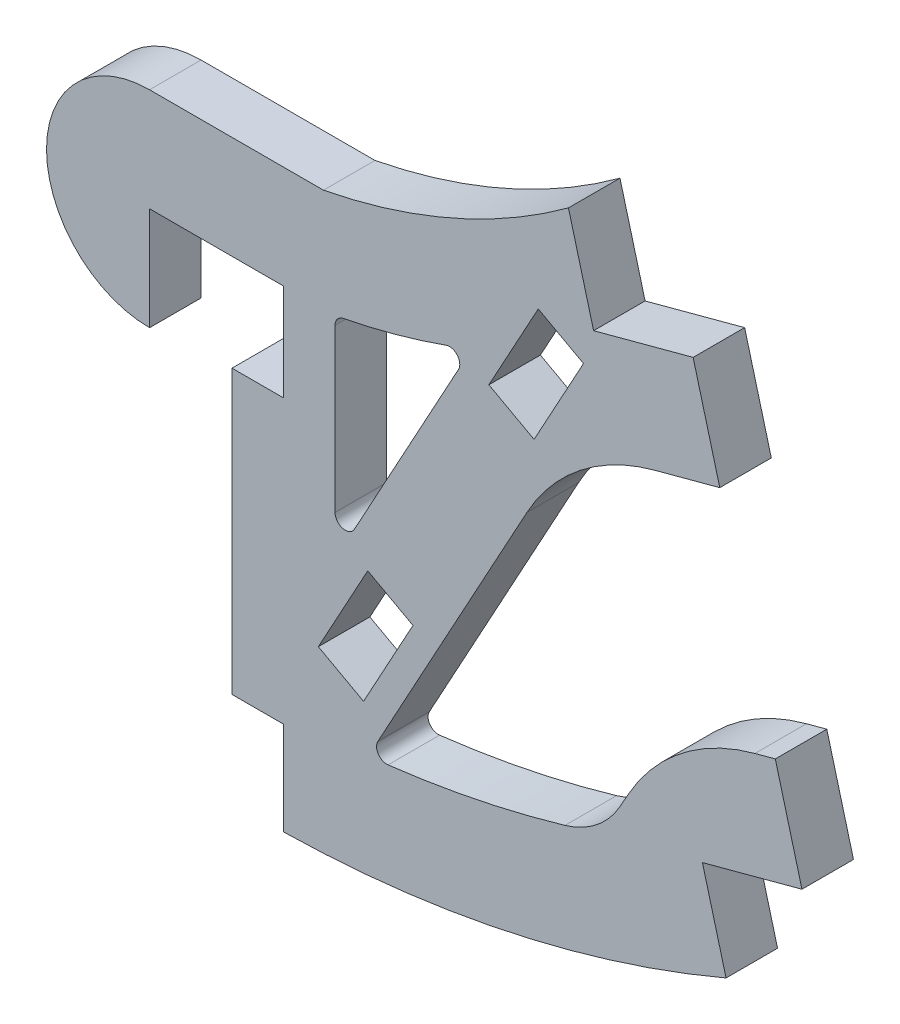
from build123d import *

# Parameters (mm, degrees)
BOSS_EXTRUDE1_DEPTH = 6.35


with BuildPart() as part:
    # Sketch1 → Boss-Extrude1 (new body)
    with BuildSketch(Plane.XY):
        with BuildLine():
            Line((-13.814468498, 55.753), (-0.512454363, 55.753))
            Line((-0.512454363, 55.753), (2.695531502, 55.756757116))
            Line((2.695531502, 55.756757116), (2.695531502, 43.818757116))
            Line((2.695531502, 43.818757116), (-3.654468498, 43.818757116))
            Line((-3.654468498, 43.818757116), (-3.654468498, 8.990868624))
            Line((-3.654468498, 8.990868624), (2.695531502, 8.990868624))
            Line((2.695531502, 8.990868624), (2.695531502, -2.512333634))
            ThreePointArc((2.695531502, -2.512333634), (30.527357476, 0.70923947), (57.236842715, 9.170472751))
            Line((57.236842715, 9.170472751), (54.325835419, 20.034499879))
            Line((54.325835419, 20.034499879), (66.593093413, 23.321501752))
            Line((66.593093413, 23.321501752), (63.30609154, 35.588759746))
            Line((63.30609154, 35.588759746), (60.796097964, 34.916208994))
            ThreePointArc((60.796097964, 34.916208994), (51.793653569, 30.444949555), (45.230580184, 22.831656326))
            Line((45.230580184, 22.831656326), (44.147031561, 20.904803413))
            ThreePointArc((44.147031561, 20.904803413), (41.295489117, 17.558815877), (37.391946488, 15.536618596))
            ThreePointArc((37.391946488, 15.536618596), (26.579212526, 12.858245248), (15.581150656, 11.088630994))
            ThreePointArc((15.581150656, 11.088630994), (14.379521981, 11.63871145), (14.317303994, 12.958798154))
            Line((14.317303994, 12.958798154), (32.704850479, 46.608917104))
            ThreePointArc((32.704850479, 46.608917104), (39.295996489, 54.397381198), (48.420216702, 58.963778482))
            Line((48.420216702, 58.963778482), (56.465172321, 61.119417843))
            Line((56.465172321, 61.119417843), (53.178170448, 73.386675837))
            Line((53.178170448, 73.386675837), (40.910912454, 70.099673965))
            Line((40.910912454, 70.099673965), (37.813569329, 81.659115874))
            ThreePointArc((37.813569329, 81.659115874), (23.44688739, 73.388727882), (7.621608316, 68.453))
            Line((7.621608316, 68.453), (-13.814468498, 68.453))
            ThreePointArc((-13.814468498, 68.453), (-26.514468498, 55.753), (-13.814468498, 43.053))
            Line((-13.814468498, 43.053), (-13.814468498, 55.753))
        make_face()
        with BuildLine():
            Line((24.264057522, 57.64700047), (11.43, 34.160040827))
            ThreePointArc((11.43, 34.160040827), (10.00126648, 33.538520613), (9.045531502, 34.769023557))
            Line((9.045531502, 34.769023557), (9.045531502, 54.745185852))
            ThreePointArc((9.045531502, 54.745185852), (9.335322516, 55.552706963), (10.072445431, 55.991704669))
            ThreePointArc((10.072445431, 55.991704669), (16.462813232, 57.486670752), (22.724329021, 59.452667759))
            ThreePointArc((22.724329021, 59.452667759), (24.115953694, 59.080021624), (24.264057522, 57.64700047))
        make_face(mode=Mode.SUBTRACT)
        Polygon((33.576896794, 54.82609289), (28.004554301, 57.871006542), (34.094381606, 69.015691526), (39.666724099, 65.970777874), align=None, mode=Mode.SUBTRACT)
        Polygon((18.649366076, 27.507973818), (13.077023583, 30.552887471), (6.987196278, 19.408202487), (12.559538771, 16.363288834), align=None, mode=Mode.SUBTRACT)
    extrude(amount=BOSS_EXTRUDE1_DEPTH)


solid = part.part
